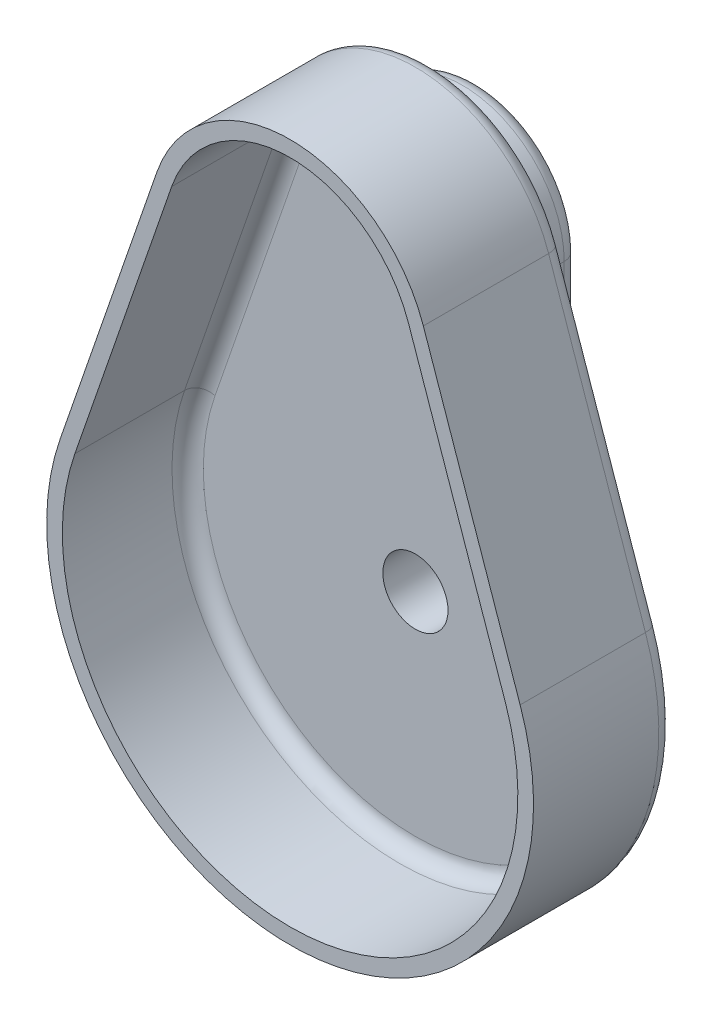
from build123d import *

# Parameters (mm, degrees)
SKETCH1_R           = 3.302
BOSS_EXTRUDE1_DEPTH = 6.35
BOSS_EXTRUDE2_START = -4.7625
SKETCH2_R           = 3.302
BOSS_EXTRUDE2_DEPTH = 1.5875
BOSS_EXTRUDE3_DEPTH = 12.7
FILLET1_R           = 1.5875
FILLET2_R           = 1.5875


with BuildPart() as part:
    # Sketch1 → Boss-Extrude1 (new body)
    with BuildSketch(Plane.XY):
        with BuildLine():
            Line((10.31875, 31.75), (10.31875, 0))
            ThreePointArc((10.31875, 0), (0, -10.31875), (-10.31875, 0))
            Line((-10.31875, 0), (-10.31875, 31.75))
            ThreePointArc((-10.31875, 31.75), (0, 42.06875), (10.31875, 31.75))
        make_face()
        Circle(SKETCH1_R, mode=Mode.SUBTRACT)
        with Locations((0, 31.75)):
            Circle(SKETCH1_R, mode=Mode.SUBTRACT)
    extrude(amount=BOSS_EXTRUDE1_DEPTH)

    # Sketch2 → Boss-Extrude2 (add)
    with BuildSketch(Plane(origin=(0, 0, 0), x_dir=(-1, 0, 0), z_dir=(0, 0, -1)).offset(BOSS_EXTRUDE2_START)):
        with BuildLine():
            Line((-23.31351417, 8.06700825), (-13.502035234, 36.4220125))
            ThreePointArc((-13.502035234, 36.4220125), (0, 46.0375), (13.502035234, 36.4220125))
            Line((13.502035234, 36.4220125), (23.31351417, 8.06700825))
            ThreePointArc((23.31351417, 8.06700825), (0, -24.66975), (-23.31351417, 8.06700825))
        make_face()
        with Locations(Location((0, 0, 0), (0, 0, 180))):
            Circle(SKETCH2_R, mode=Mode.SUBTRACT)
        with Locations(Location((0, 31.75, 0), (0, 0, 180))):
            Circle(SKETCH2_R, mode=Mode.SUBTRACT)
    extrude(amount=-BOSS_EXTRUDE2_DEPTH)

    # Sketch3 → Boss-Extrude3 (add)
    with BuildSketch(Plane.XY.offset(6.35)):
        with BuildLine():
            Line((-13.502035234, 36.4220125), (-23.31351417, 8.06700825))
            ThreePointArc((-23.31351417, 8.06700825), (0, -24.66975), (23.31351417, 8.06700825))
            Line((23.31351417, 8.06700825), (13.502035234, 36.4220125))
            ThreePointArc((13.502035234, 36.4220125), (0, 46.0375), (-13.502035234, 36.4220125))
        make_face()
        with BuildLine():
            Line((21.813288033, 7.54789575), (12.001809097, 35.9029))
            ThreePointArc((12.001809097, 35.9029), (0, 44.45), (-12.001809097, 35.9029))
            Line((-12.001809097, 35.9029), (-21.813288033, 7.54789575))
            ThreePointArc((-21.813288033, 7.54789575), (0, -23.08225), (21.813288033, 7.54789575))
        make_face(mode=Mode.SUBTRACT)
    extrude(amount=BOSS_EXTRUDE3_DEPTH)

    # Fillet1
    fillet1_edges = [part.edges().sort_by_distance(p)[0] for p in [
        (10.31875, 15.875, 4.7625),
        (0, 42.06875, 4.7625),
        (-10.31875, 15.875, 4.7625),
        (0, -10.31875, 4.7625),
        (0, 46.0375, 4.7625),
        (18.407774702, 22.244510375, 4.7625),
        (0, -24.66975, 4.7625),
        (-18.407774702, 22.244510375, 4.7625),
        (0, -23.08225, 6.35),
        (16.907548565, 21.725397875, 6.35),
        (0, 44.45, 6.35),
        (-16.907548565, 21.725397875, 6.35),
    ]]
    fillet(fillet1_edges, radius=FILLET1_R)

    # Fillet2
    fillet2_edges = [part.edges().sort_by_distance(p)[0] for p in [
        (10.31875, 15.875, 0),
        (0, -10.31875, 0),
        (-10.31875, 15.875, 0),
        (0, 42.06875, 0),
    ]]
    fillet(fillet2_edges, radius=FILLET2_R)


solid = part.part
